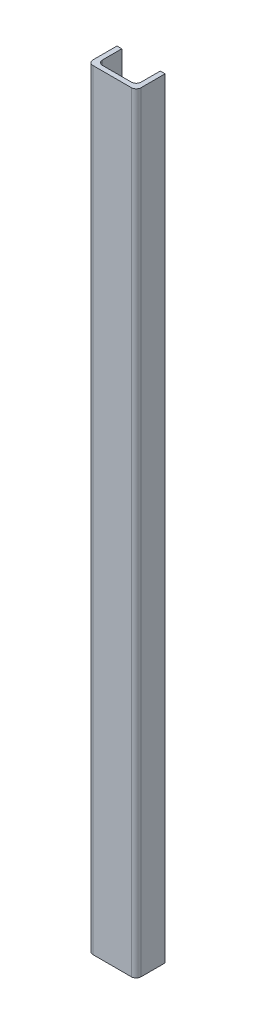
from build123d import *

# Parameters (mm, degrees)
BOSS_EXTRUDE2_DEPTH = 800


with BuildPart() as part:
    # Sketch1 → Boss-Extrude2 (new body)
    with BuildSketch(Plane(origin=(0, 0, 0), x_dir=(1, 0, 0), z_dir=(0, 1, 0))):
        with BuildLine():
            Line((-15, 2.5), (15, 2.5))
            ThreePointArc((15, 2.5), (18.535533906, 3.964466094), (20, 7.5))
            Line((20, 7.5), (20, 27.5))
            Line((20, 27.5), (25, 27.5))
            Line((25, 27.5), (25, 2.5))
            ThreePointArc((25, 2.5), (23.535533906, -1.035533906), (20, -2.5))
            Line((20, -2.5), (-20, -2.5))
            ThreePointArc((-20, -2.5), (-23.535533906, -1.035533906), (-25, 2.5))
            Line((-25, 2.5), (-25, 27.5))
            Line((-25, 27.5), (-20, 27.5))
            Line((-20, 27.5), (-20, 7.5))
            ThreePointArc((-20, 7.5), (-18.535533906, 3.964466094), (-15, 2.5))
        make_face()
    extrude(amount=BOSS_EXTRUDE2_DEPTH)


solid = part.part
